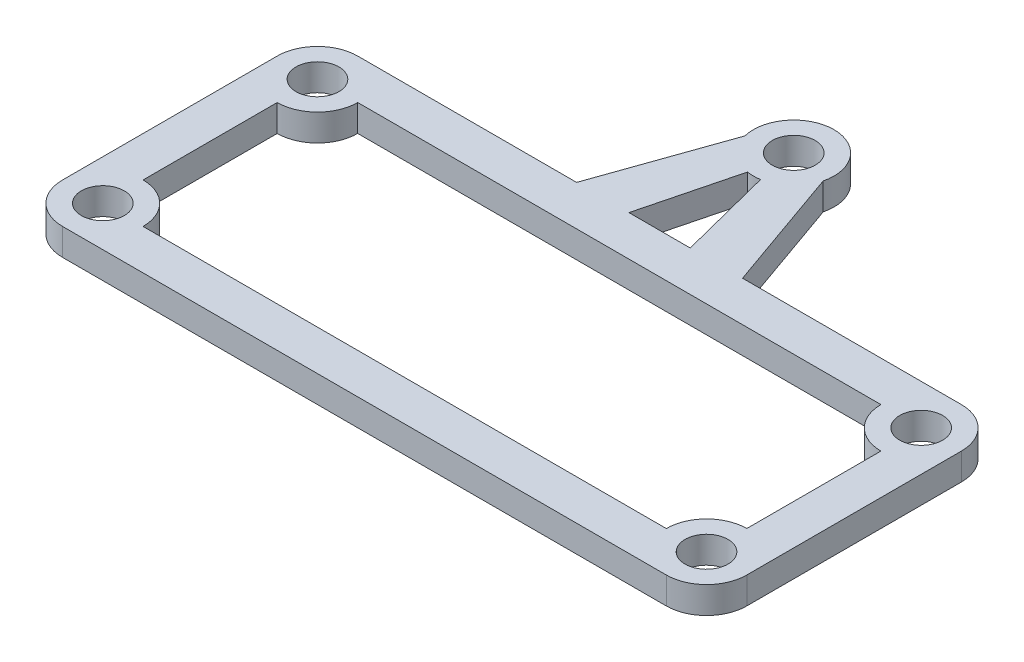
from build123d import *

# Parameters (mm, degrees)
SKETCH1_R           = 1.6
BOSS_EXTRUDE1_DEPTH = 2


with BuildPart() as part:
    # Sketch1 → Boss-Extrude1 (new body)
    with BuildSketch(Plane(origin=(0, 0, 0), x_dir=(1, 0, 0), z_dir=(0, 1, 0))):
        with BuildLine():
            Line((6.185029122, 11), (22.5, 11))
            ThreePointArc((22.5, 11), (24.621320344, 10.121320344), (25.5, 8))
            Line((25.5, 8), (25.5, -8))
            ThreePointArc((25.5, -8), (24.621320344, -10.121320344), (22.5, -11))
            Line((22.5, -11), (-22.5, -11))
            ThreePointArc((-22.5, -11), (-24.621320344, -10.121320344), (-25.5, -8))
            Line((-25.5, -8), (-25.5, 8))
            ThreePointArc((-25.5, 8), (-24.621320344, 10.121320344), (-22.5, 11))
            Line((-22.5, 11), (-6.185029122, 11))
            Line((-6.185029122, 11), (-2.912197092, 20.279508432))
            ThreePointArc((-2.912197092, 20.279508432), (0, 24), (2.912197092, 20.279508432))
            Line((2.912197092, 20.279508432), (6.185029122, 11))
        make_face()
        with Locations(Location((-22.5, 8, 0), (0, 0, 270))):
            Circle(SKETCH1_R, mode=Mode.SUBTRACT)
        with Locations(Location((-22.5, -8, 0), (0, 0, 270))):
            Circle(SKETCH1_R, mode=Mode.SUBTRACT)
        with Locations(Location((22.5, -8, 0), (0, 0, 270))):
            Circle(SKETCH1_R, mode=Mode.SUBTRACT)
        with Locations(Location((22.5, 8, 0), (0, 0, 270))):
            Circle(SKETCH1_R, mode=Mode.SUBTRACT)
        with Locations(Location((0, 21, 0), (0, 0, 270))):
            Circle(SKETCH1_R, mode=Mode.SUBTRACT)
        with BuildLine():
            Line((-0.487430468, 18.039862919), (-2.28542798, 11))
            Line((-2.28542798, 11), (2.28542798, 11))
            Line((2.28542798, 11), (0.487430468, 18.039862919))
            ThreePointArc((0.487430468, 18.039862919), (0, 18), (-0.487430468, 18.039862919))
        make_face(mode=Mode.SUBTRACT)
        with BuildLine():
            Line((-19.5, -8), (19.5, -8))
            ThreePointArc((19.5, -8), (20.378679656, -5.878679656), (22.5, -5))
            Line((22.5, -5), (22.5, 5))
            ThreePointArc((22.5, 5), (20.378679656, 5.878679656), (19.5, 8))
            Line((19.5, 8), (-19.5, 8))
            ThreePointArc((-19.5, 8), (-20.378679656, 5.878679656), (-22.5, 5))
            Line((-22.5, 5), (-22.5, -5))
            ThreePointArc((-22.5, -5), (-20.378679656, -5.878679656), (-19.5, -8))
        make_face(mode=Mode.SUBTRACT)
    extrude(amount=BOSS_EXTRUDE1_DEPTH)


solid = part.part
